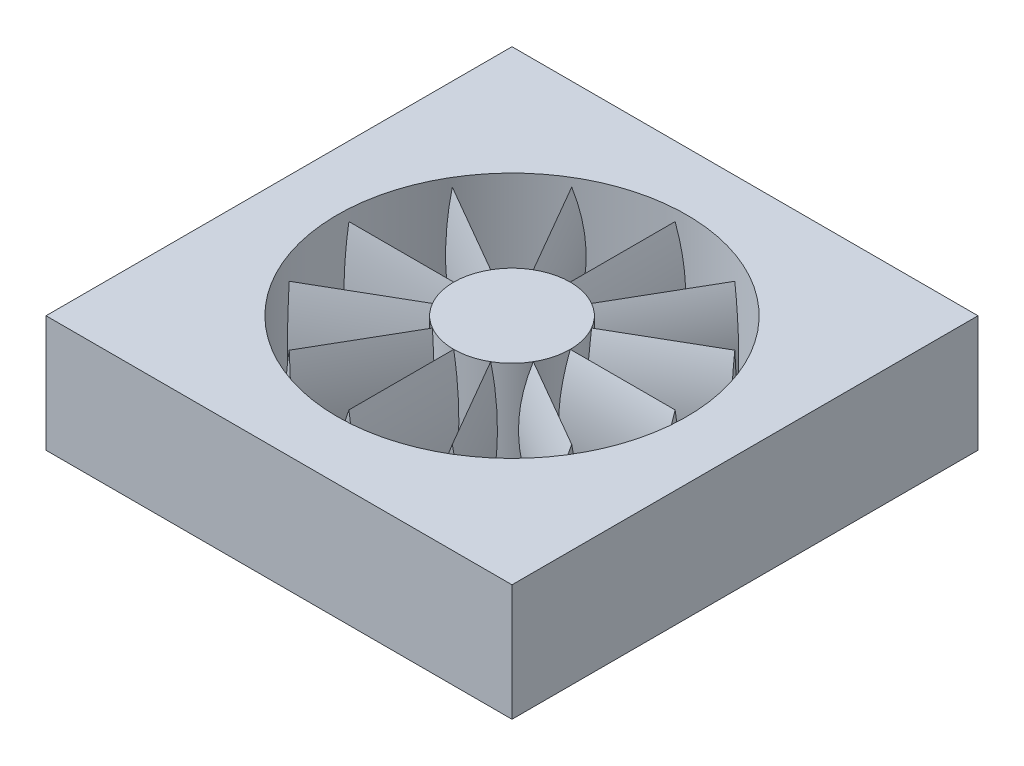
from build123d import *

# Parameters (mm, degrees)
SKETCH_1_W               = 40
SKETCH_1_H               = 40
SKETCH_1_R               = 15
EXTRUDE_1_DEPTH          = 10
SKETCH_1_R_2             = 5
EXTRUDE_1_2_DEPTH        = 10
EXTRUDE_2_DEPTH          = 14
PATTERN_CIRCULAR_1_COUNT = 12


with BuildPart() as part:
    # 草图1 → 凸台-拉伸1 (new body)
    with BuildSketch(Plane(origin=(0, 0, 0), x_dir=(1, 0, 0), z_dir=(0, 1, 0))):
        with Locations((5.650969529, -7.313019391)):
            Rectangle(SKETCH_1_W, SKETCH_1_H)
        with Locations(Location((5.650969529, -7.313019391, 0), (0, 0, 270))):
            Circle(SKETCH_1_R, mode=Mode.SUBTRACT)
    extrude(amount=EXTRUDE_1_DEPTH)


with BuildPart() as body_2:
    # 草图1 → Extrude 1 2 (new body)
    with BuildSketch(Plane(origin=(0, 0, 0), x_dir=(1, 0, 0), z_dir=(0, 1, 0))):
        with Locations(Location((5.650969529, -7.313019391, 0), (0, 0, 270))):
            Circle(SKETCH_1_R_2)
    extrude(amount=EXTRUDE_1_2_DEPTH)

    # 草图2 → 凸台-拉伸2 (add)
    with BuildSketch(Plane.ZY.offset(-5.650969529)):
        with BuildLine():
            ThreePointArc((7.313019391, 10), (6.403068689, 5), (7.313019391, 0))
            ThreePointArc((7.313019391, 0), (7.733487975, 5), (7.313019391, 10))
        make_face()
    extrude_2 = extrude(amount=EXTRUDE_2_DEPTH)

    # 阵列(圆周)1: 凸台-拉伸2 ×12 about axis
    pattern_circular_1_axis = Axis((5.650969529, 0, 7.313019391), (0, 1, 0))
    for i in range(1, PATTERN_CIRCULAR_1_COUNT):
        add(extrude_2.rotate(pattern_circular_1_axis, i * 360 / PATTERN_CIRCULAR_1_COUNT))


solid = Compound([part.part, body_2.part])
